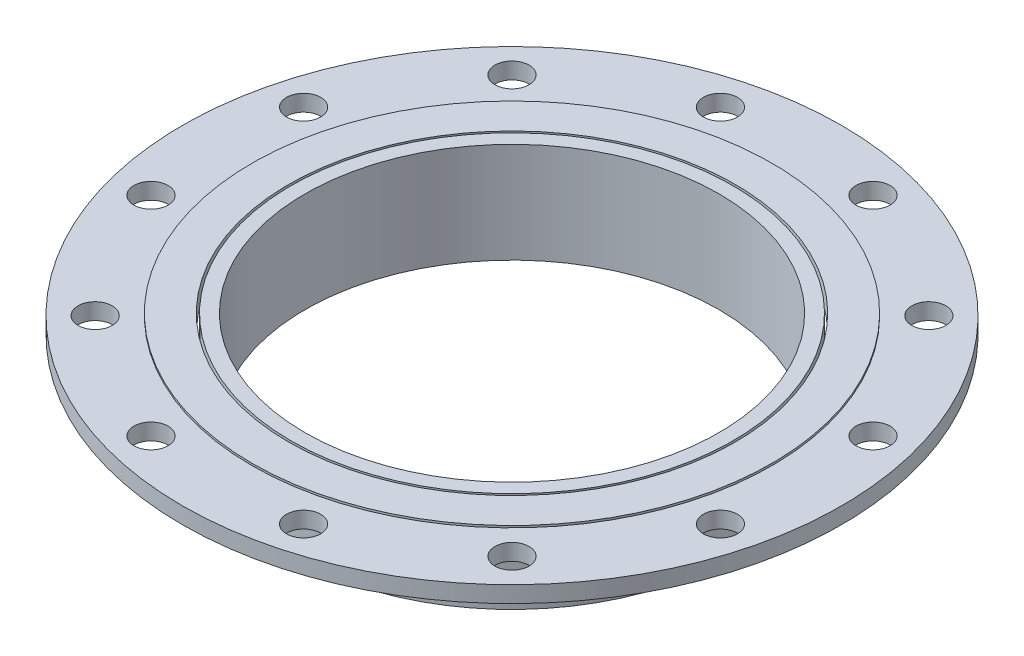
from build123d import *

# Parameters (mm, degrees)
SKETCH9_R           = 241.5
SKETCH9_R_2         = 163.6
BOSS_EXTRUDE1_DEPTH = 12
SKETCH10_R          = 12.5
CUT_EXTRUDE1_DEPTH  = 12
CIRPATTERN1_COUNT   = 12
SKETCH11_R          = 190.5
SKETCH11_R_2        = 163.6
BOSS_EXTRUDE2_DEPTH = 1.5
SKETCH12_R          = 161.95
SKETCH12_R_2        = 151.64
BOSS_EXTRUDE3_DEPTH = 73.5


with BuildPart() as part:
    # Sketch9 → Boss-Extrude1 (new body)
    with BuildSketch(Plane(origin=(0, 400, 0), x_dir=(1, 0, 0), z_dir=(0, 1, 0))):
        with Locations(Location((0, 0, 0), (0, 0, 270))):
            Circle(SKETCH9_R)
        with Locations(Location((0, 0, 0), (0, 0, 270))):
            Circle(SKETCH9_R_2, mode=Mode.SUBTRACT)
    extrude(amount=BOSS_EXTRUDE1_DEPTH)

    # Sketch10 → Cut-Extrude1 (cut)
    with BuildSketch(Plane(origin=(0, 412, 0), x_dir=(1, 0, 0), z_dir=(0, 1, 0))):
        with Locations(Location((-55.904913742, 208.639978478, 0), (0, 0, 270))):
            Circle(SKETCH10_R)
    cut_extrude1 = extrude(amount=-CUT_EXTRUDE1_DEPTH, mode=Mode.SUBTRACT)

    # CirPattern1: Cut-Extrude1 ×12 about axis
    cirpattern1_axis = Axis((0, 0, 0), (0, 1, 0))
    for i in range(1, CIRPATTERN1_COUNT):
        add(cut_extrude1.rotate(cirpattern1_axis, i * 360 / CIRPATTERN1_COUNT), mode=Mode.SUBTRACT)

    # Sketch11 → Boss-Extrude2 (add)
    with BuildSketch(Plane(origin=(0, 412, 0), x_dir=(1, 0, 0), z_dir=(0, 1, 0))):
        with Locations(Location((0, 0, 0), (0, 0, 270))):
            Circle(SKETCH11_R)
        with Locations(Location((0, 0, 0), (0, 0, 270))):
            Circle(SKETCH11_R_2, mode=Mode.SUBTRACT)
    extrude(amount=BOSS_EXTRUDE2_DEPTH)


with BuildPart() as body_2:
    # Sketch12 → Boss-Extrude3 (new body)
    with BuildSketch(Plane(origin=(0, 413.5, 0), x_dir=(1, 0, 0), z_dir=(0, 1, 0))):
        with Locations(Location((0, 0, 0), (0, 0, 270))):
            Circle(SKETCH12_R)
        with Locations(Location((0, 0, 0), (0, 0, 270))):
            Circle(SKETCH12_R_2, mode=Mode.SUBTRACT)
    extrude(amount=-BOSS_EXTRUDE3_DEPTH)


solid = Compound([part.part, body_2.part])
